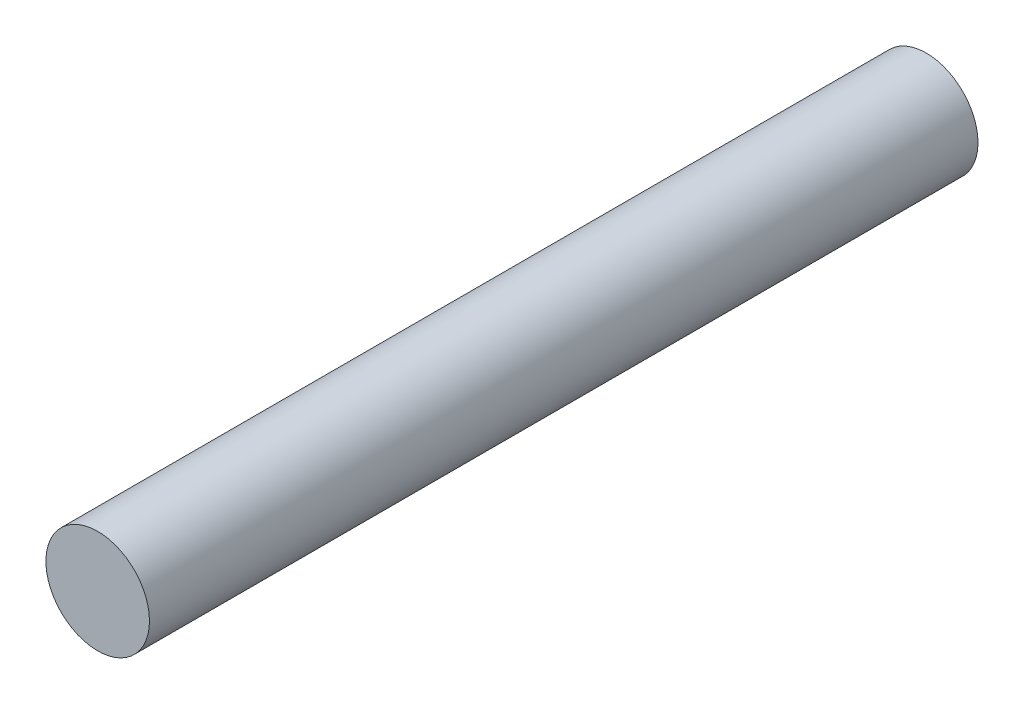
from build123d import *

# Parameters (mm, degrees)
SKETCH1_R           = 3
BOSS_EXTRUDE1_DEPTH = 48


with BuildPart() as part:
    # Sketch1 → Boss-Extrude1 (new body)
    with BuildSketch(Plane.XY):
        Circle(SKETCH1_R)
    extrude(amount=BOSS_EXTRUDE1_DEPTH)


solid = part.part
